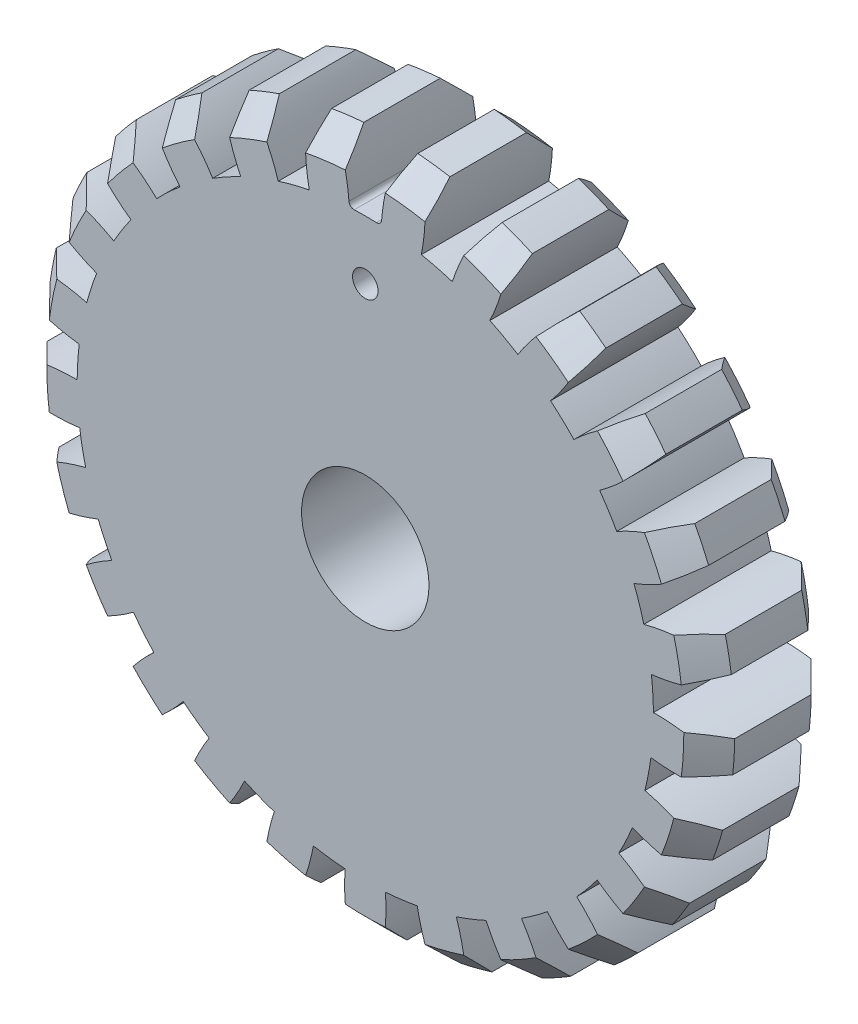
from build123d import *

# Parameters (mm, degrees)
SKETCH1_R               = 27
BOSS_EXTRUDE1_DEPTH     = 5
CUT_EXTRUDE1_DEPTH      = 39.509739028
FILLET1_R               = 0.4
CHAMFER1_SIZE           = 2
CIRPATTERN26_COUNT      = 25
CUT_EXTRUDE2_DEPTH      = 39.507418438
CUT_EXTRUDE2_DEPTH_BACK = 39.507418438
SKETCH1_4_R             = 5
CUT_EXTRUDE3_DEPTH      = 40.469244682
CUT_EXTRUDE3_DEPTH_BACK = 40.469244682
SKETCH6_R               = 1


with BuildPart() as part:
    # Sketch1 → Boss-Extrude1 (new, symmetric)
    with BuildSketch(Plane.XY):
        Circle(SKETCH1_R)
    extrude(amount=BOSS_EXTRUDE1_DEPTH, both=True)

    # Sketch1<3> → Cut-Extrude1 (cut, symmetric)
    with BuildSketch(Plane.XY):
        with BuildLine():
            Line((-45.825337074, 152.05674595), (-2.117074952, 26.916871914))
            ThreePointArc((-2.117074952, 26.916871914), (-1.534533311, 24.778097381), (-1.256617407, 22.578898886))
            ThreePointArc((-1.256617407, 22.578898886), (0, 22.613840059), (1.256617407, 22.578898886))
            ThreePointArc((1.256617407, 22.578898886), (1.534533311, 24.778097381), (2.117074952, 26.916871914))
            Line((2.117074952, 26.916871914), (45.825337074, 152.05674595))
            Line((45.825337074, 152.05674595), (45.825337074, 417.163518791))
            Line((45.825337074, 417.163518791), (-45.825337074, 417.163518791))
            Line((-45.825337074, 417.163518791), (-45.825337074, 152.05674595))
        make_face()
    cut_extrude1 = extrude(amount=CUT_EXTRUDE1_DEPTH, both=True, mode=Mode.SUBTRACT)

    # Fillet1
    fillet1_edges = [part.edges().sort_by_distance(p)[0] for p in [
        (1.256617407, 22.578898886, 0),
        (-1.256617407, 22.578898886, 0),
    ]]
    fillet(fillet1_edges, radius=FILLET1_R)

    # Chamfer1
    chamfer1_edges = [part.edges().sort_by_distance(p)[0] for p in [
        (0, -27, -5),
        (0, -27, 5),
    ]]
    chamfer(chamfer1_edges, length=CHAMFER1_SIZE)

    # CirPattern26: Cut-Extrude1 ×25 about axis
    cirpattern26_axis = Axis((0, 0, 5), (0, 0, -1))
    for i in range(1, CIRPATTERN26_COUNT):
        add(cut_extrude1.rotate(cirpattern26_axis, i * 360 / CIRPATTERN26_COUNT), mode=Mode.SUBTRACT)

    # Sketch1<4> → Cut-Extrude2 (cut, two sides: drawn at the far end of the back side and taken through both)
    with BuildSketch(Plane.XY.offset(-CUT_EXTRUDE2_DEPTH_BACK)):
        Circle(SKETCH1_4_R)
    extrude(amount=CUT_EXTRUDE2_DEPTH + CUT_EXTRUDE2_DEPTH_BACK, mode=Mode.SUBTRACT)

    # Sketch6 → Cut-Extrude3 (cut, two sides: drawn at the far end of the back side and taken through both)
    with BuildSketch(Plane(origin=(0, 0, -5), x_dir=(-1, 0, 0), z_dir=(0, 0, -1)).offset(-CUT_EXTRUDE3_DEPTH_BACK)):
        with Locations((0, 18)):
            Circle(SKETCH6_R)
    extrude(amount=CUT_EXTRUDE3_DEPTH + CUT_EXTRUDE3_DEPTH_BACK, mode=Mode.SUBTRACT)


solid = part.part
